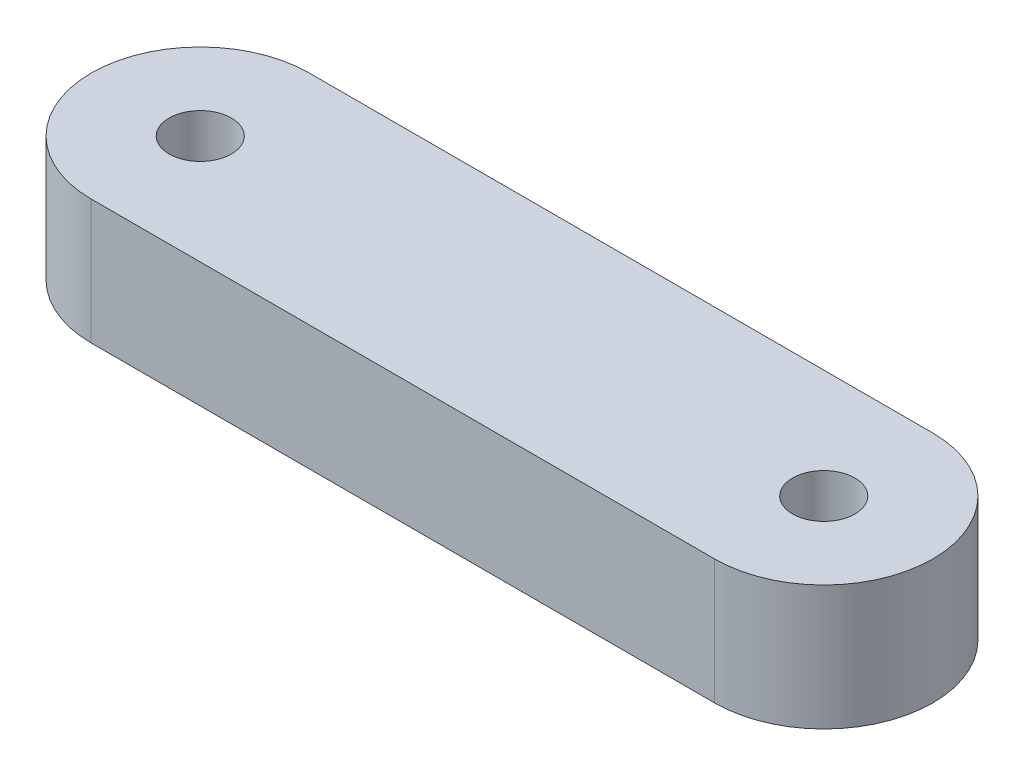
from build123d import *

# Parameters (mm, degrees)
SKETCH1_R           = 2.5
BOSS_EXTRUDE1_DEPTH = 10


with BuildPart() as part:
    # Sketch1 → Boss-Extrude1 (new body)
    with BuildSketch(Plane(origin=(0, 0, 0), x_dir=(1, 0, 0), z_dir=(0, 1, 0))):
        with BuildLine():
            Line((0, -8.746700341), (-50, -8.746700341))
            ThreePointArc((-50, -8.746700341), (-58.746700341, 0), (-50, 8.746700341))
            Line((-50, 8.746700341), (0, 8.746700341))
            ThreePointArc((0, 8.746700341), (8.746700341, 0), (0, -8.746700341))
        make_face()
        with Locations(Location((0, 0, 0), (0, 0, 270))):
            Circle(SKETCH1_R, mode=Mode.SUBTRACT)
        with Locations(Location((-50, 0, 0), (0, 0, 270))):
            Circle(SKETCH1_R, mode=Mode.SUBTRACT)
    extrude(amount=BOSS_EXTRUDE1_DEPTH)


solid = part.part
